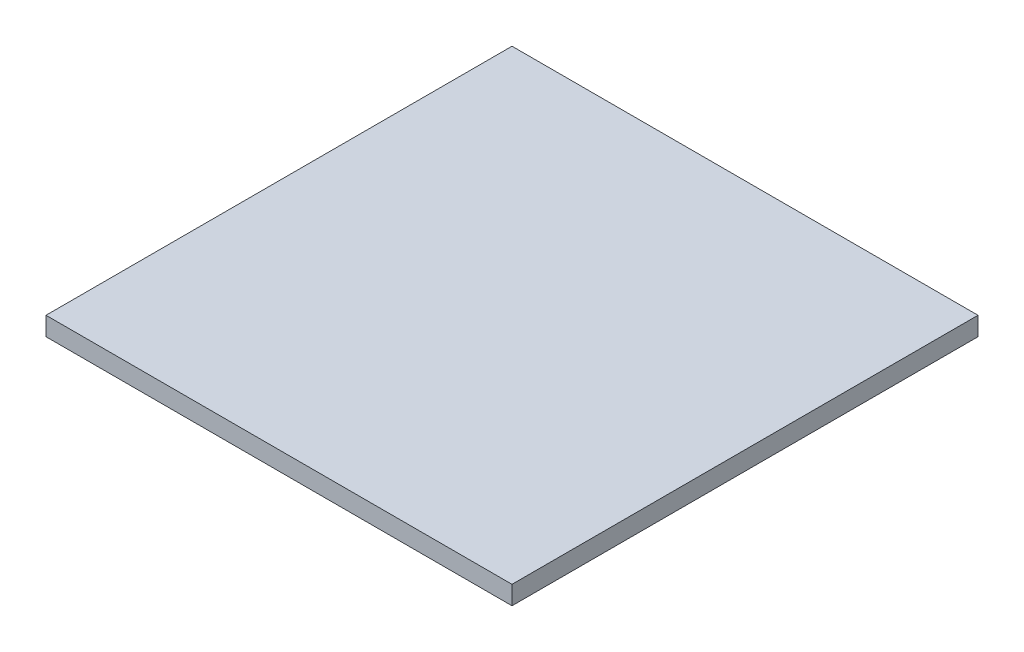
from build123d import *

# Parameters (mm, degrees)
SKETCH1_W           = 457.2
SKETCH1_H           = 457.2
BOSS_EXTRUDE1_DEPTH = 18.25625


with BuildPart() as part:
    # Sketch1 → Boss-Extrude1 (new body)
    with BuildSketch(Plane(origin=(0, 0, 0), x_dir=(1, 0, 0), z_dir=(0, 1, 0))):
        with Locations((228.6, 228.6)):
            Rectangle(SKETCH1_W, SKETCH1_H)
    extrude(amount=BOSS_EXTRUDE1_DEPTH)


solid = part.part
